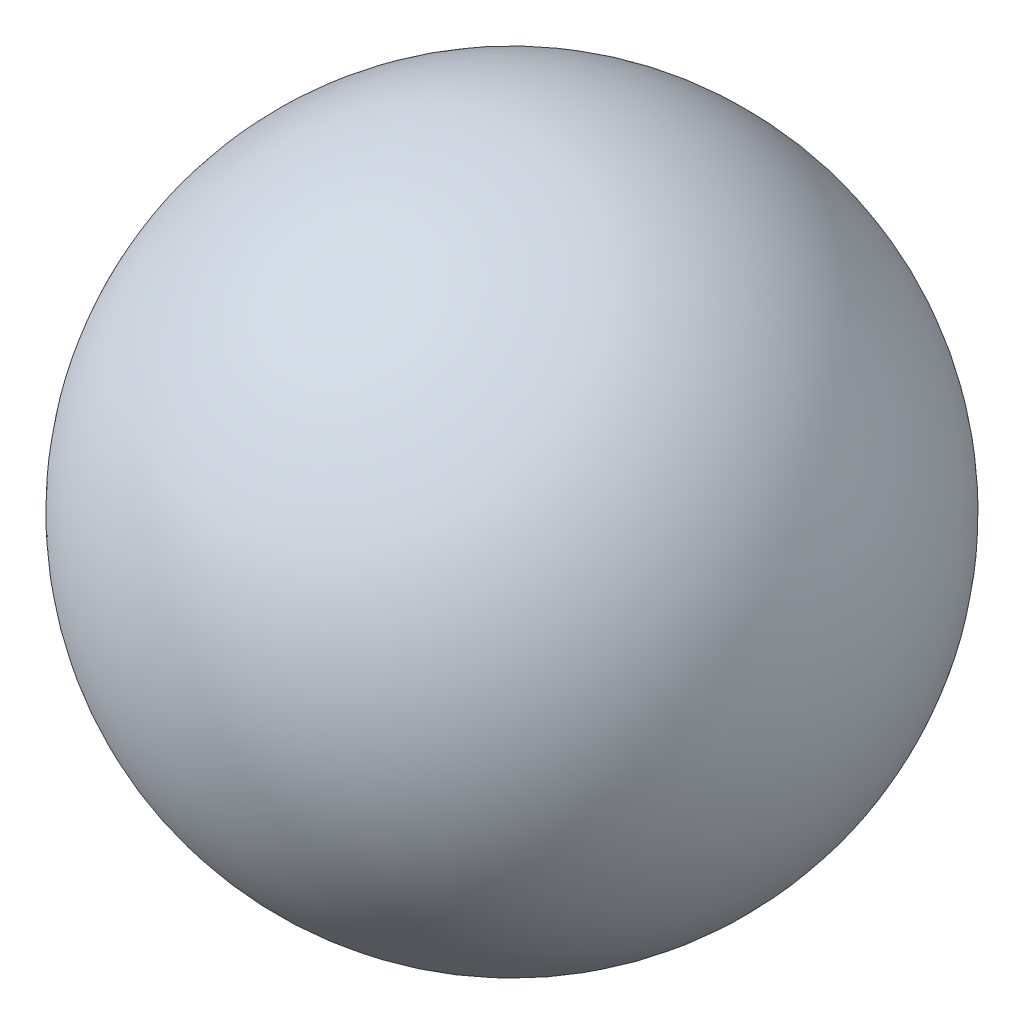
from build123d import *


with BuildPart() as part:
    # Esquisse1 → Révolution1 (revolve)
    with BuildSketch(Plane.XY):
        with BuildLine():
            Line((-2.332406652, 0), (2.167593348, 0))
            ThreePointArc((2.167593348, 0), (-0.082406652, 2.25), (-2.332406652, 0))
        make_face()
    revolve(axis=Axis((-2.332406652, 0, 0), (1, 0, 0)))


solid = part.part
